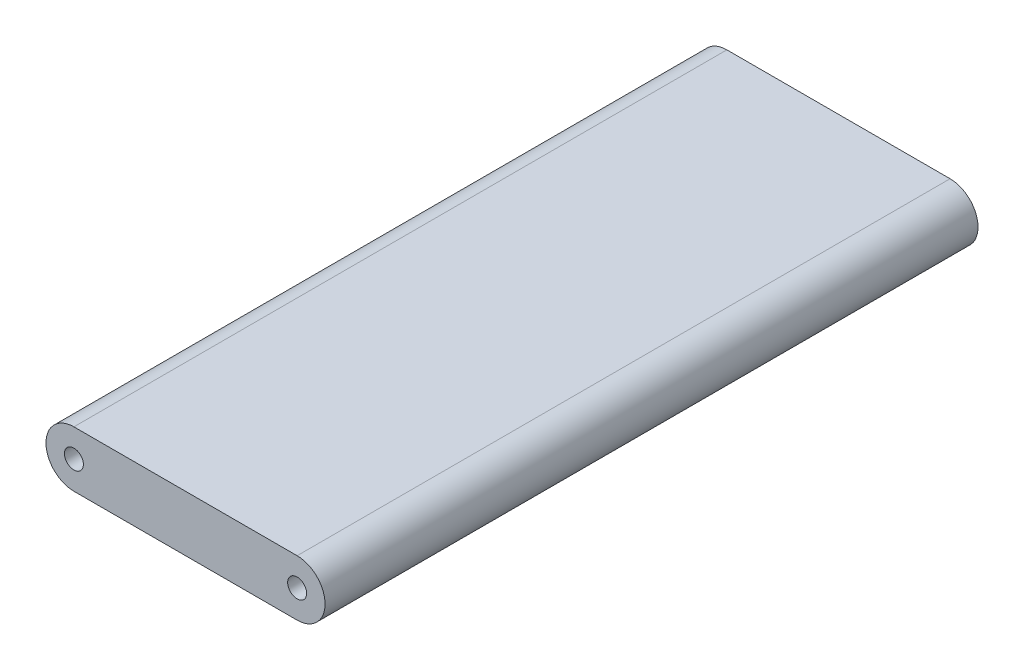
from build123d import *

# Parameters (mm, degrees)
SKETCH_1_R      = 0.85
EXTRUDE_1_DEPTH = 58.5


with BuildPart() as part:
    # ｽｹｯﾁ1 → ﾎﾞｽ - 押し出し1 (new body)
    with BuildSketch(Plane.XY):
        with BuildLine():
            Line((0, 2.5), (20, 2.5))
            ThreePointArc((20, 2.5), (22.5, 0), (20, -2.5))
            Line((20, -2.5), (0, -2.5))
            ThreePointArc((0, -2.5), (-2.5, 0), (0, 2.5))
        make_face()
        Circle(SKETCH_1_R, mode=Mode.SUBTRACT)
        with Locations((20, 0)):
            Circle(SKETCH_1_R, mode=Mode.SUBTRACT)
    extrude(amount=EXTRUDE_1_DEPTH)


solid = part.part
